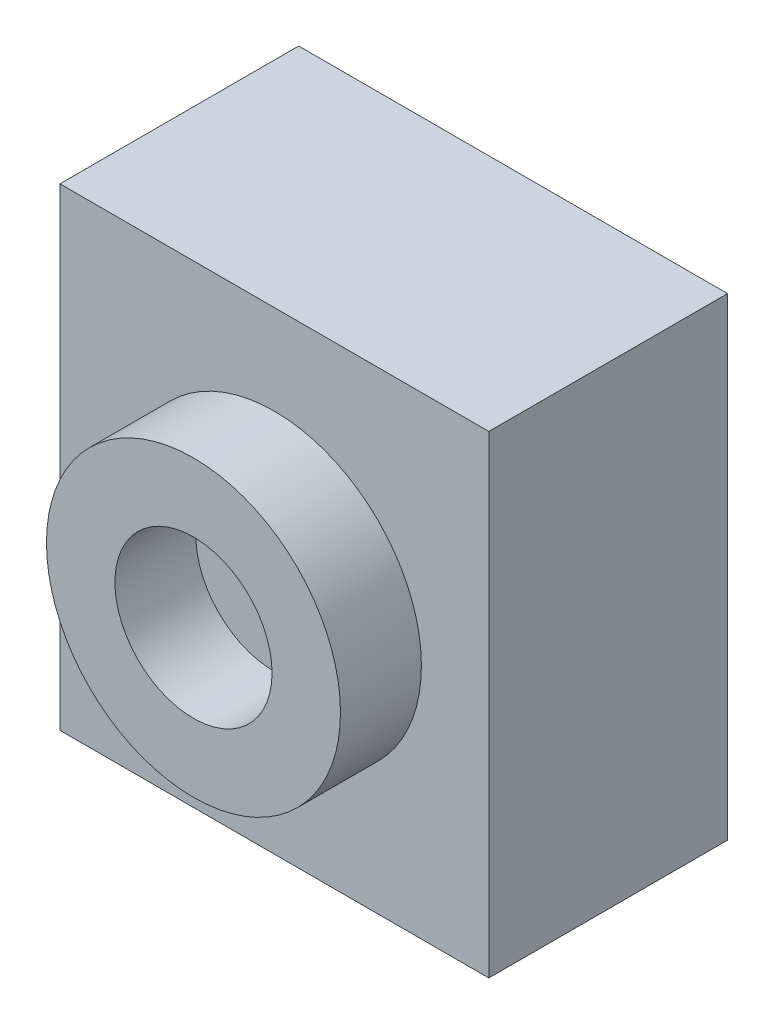
from build123d import *

# Parameters (mm, degrees)
ESQUISSE1_W        = 10.6
ESQUISSE1_H        = 11.7
BOSS_EXTRU_1_DEPTH = 5.9
ESQUISSE2_R        = 3.633546232
ESQUISSE2_R_2      = 1.941835626
BOSS_EXTRU_2_DEPTH = 2


with BuildPart() as part:
    # Esquisse1 → Boss.-Extru.1 (new body)
    with BuildSketch(Plane.XY):
        Rectangle(ESQUISSE1_W, ESQUISSE1_H)
    extrude(amount=BOSS_EXTRU_1_DEPTH)

    # Esquisse2 → Boss.-Extru.2 (add)
    with BuildSketch(Plane.XY.offset(5.9)):
        Circle(ESQUISSE2_R)
        Circle(ESQUISSE2_R_2, mode=Mode.SUBTRACT)
    extrude(amount=BOSS_EXTRU_2_DEPTH)


solid = part.part
